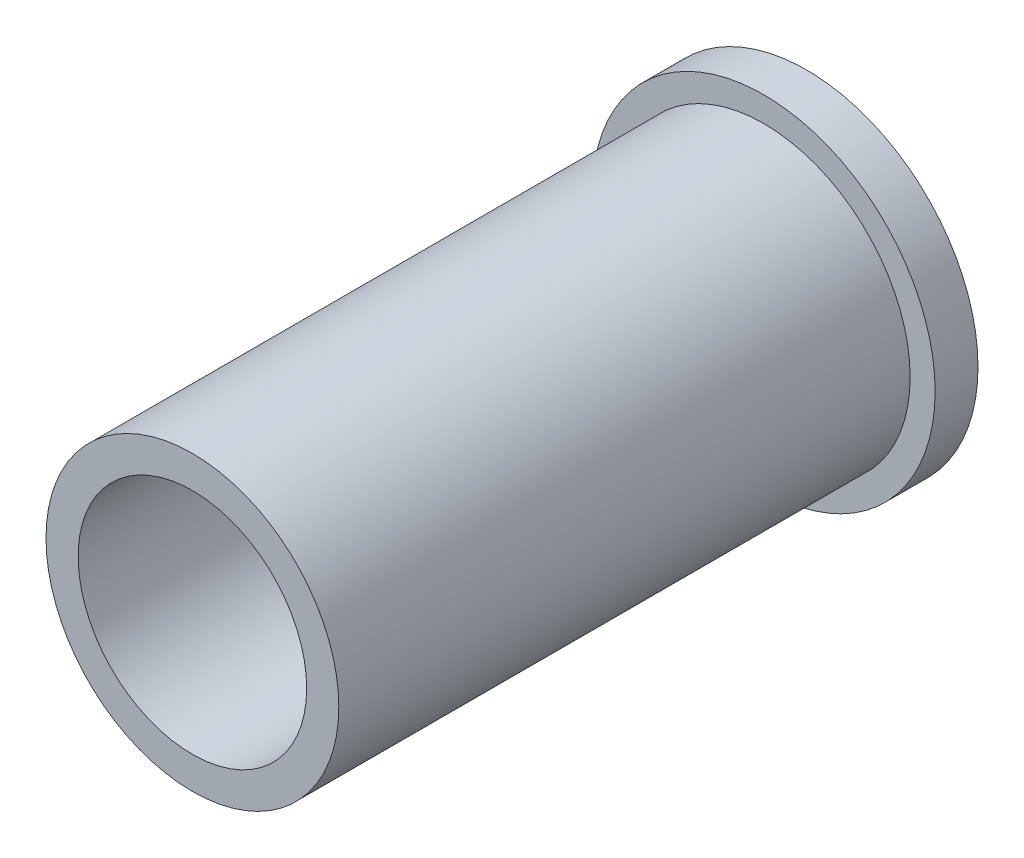
from build123d import *

# Parameters (mm, degrees)
SKETCH1_R           = 12
SKETCH1_R_2         = 8
BOSS_EXTRUDE2_DEPTH = 3
SKETCH2_R           = 10.25
SKETCH2_R_2         = 8
BOSS_EXTRUDE3_DEPTH = 40


with BuildPart() as part:
    # Sketch1 → Boss-Extrude2 (new body)
    with BuildSketch(Plane.XY):
        Circle(SKETCH1_R)
        Circle(SKETCH1_R_2, mode=Mode.SUBTRACT)
    extrude(amount=BOSS_EXTRUDE2_DEPTH)

    # Sketch2 → Boss-Extrude3 (add)
    with BuildSketch(Plane.XY.offset(3)):
        Circle(SKETCH2_R)
        Circle(SKETCH2_R_2, mode=Mode.SUBTRACT)
    extrude(amount=BOSS_EXTRUDE3_DEPTH)


solid = part.part
